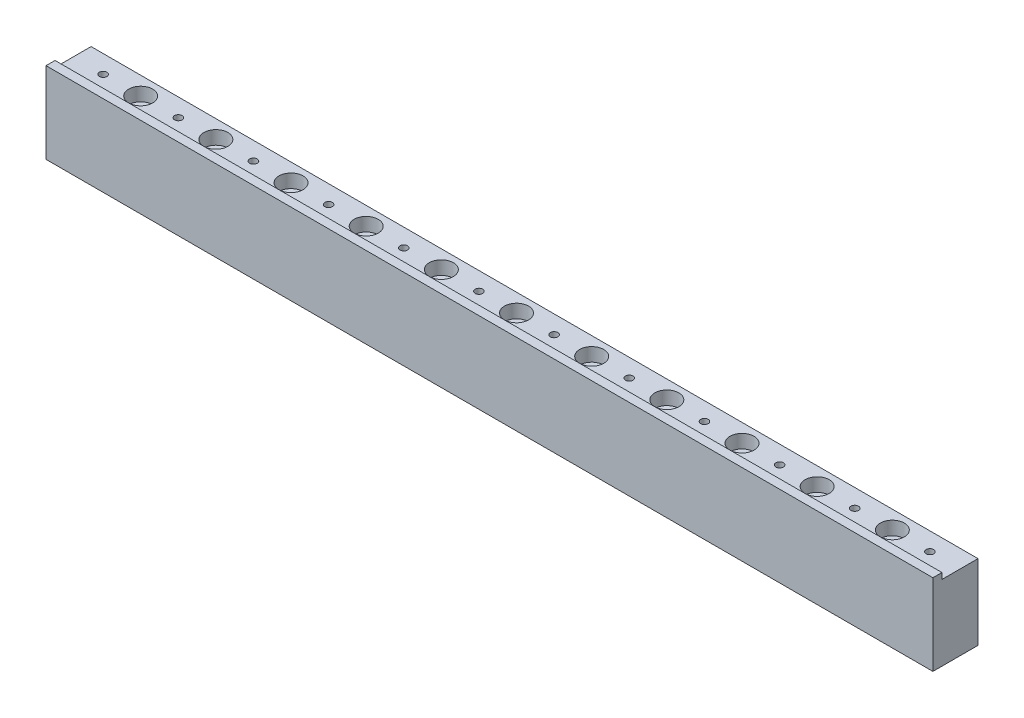
from build123d import *

# Parameters (mm, degrees)
SKETCH_2_W                   = 295
SKETCH_2_H                   = 15
EXTRUDE_1_DEPTH              = 27
PATTERN_LINEAR_1_COUNT       = 12
PATTERN_LINEAR_1_PITCH       = 25
CUT_EXTRUDE_1_REACH          = 298.37
SKETCH_6_W                   = 12
SKETCH_6_H                   = 2
HOLE_WIZARD_M4_1_D           = 4.5
HOLE_WIZARD_M4_1_CBORE_D     = 8
HOLE_WIZARD_M4_1_CBORE_DEPTH = 4.5
PATTERN_LINEAR_2_COUNT       = 11
PATTERN_LINEAR_2_PITCH       = 25


with BuildPart() as part:
    # 草图2 → 拉伸1 (new body)
    with BuildSketch(Plane(origin=(0, 0, 0), x_dir=(1, 0, 0), z_dir=(0, 1, 0))):
        with Locations((147.5, -1.5)):
            Rectangle(SKETCH_2_W, SKETCH_2_H)
    extrude(amount=EXTRUDE_1_DEPTH)

    # 草图4 → M3 螺纹孔1 (revolve, cut)
    with BuildSketch(Plane(origin=(10, 27, 0), x_dir=(0, 0, 1), z_dir=(1, 0, 0))):
        Polygon((0, 0), (0, 8.251075774), (1.25, 7.5), (1.25, 0), align=None)
    hole_wizard_m3_1 = revolve(axis=Axis((10, 33.35, 0), (0, -1, 0)), mode=Mode.SUBTRACT)

    # 阵列(线性)1: M3 螺纹孔1 ×12
    with Locations(*[(i * PATTERN_LINEAR_1_PITCH, 0, 0) for i in range(1, PATTERN_LINEAR_1_COUNT)]):
        add(hole_wizard_m3_1, mode=Mode.SUBTRACT)

    # 草图6 → 切除-拉伸1 (cut, up to next)
    with BuildSketch(Plane(origin=(295, 0, 0), x_dir=(0, 0, -1), z_dir=(1, 0, 0)), mode=Mode.PRIVATE) as cut_extrude_1_sk1:
        with Locations((0, 26)):
            Rectangle(SKETCH_6_W, SKETCH_6_H)
    cut_extrude_1_tool1 = extrude(cut_extrude_1_sk1.sketch, amount=-CUT_EXTRUDE_1_REACH, mode=Mode.PRIVATE) & part.part
    add(cut_extrude_1_tool1.solids().sort_by_distance((295, 26, 0))[0], mode=Mode.SUBTRACT)

    # M4 六角凹头螺钉的柱形沉头孔1 (through all)
    with Locations(Plane(origin=(0, 25, 0), x_dir=(-1, 0, 0), z_dir=(0, 1, 0))):
        with Locations((-22.5, 0)):
            hole_wizard_m4_1 = CounterBoreHole(HOLE_WIZARD_M4_1_D / 2, HOLE_WIZARD_M4_1_CBORE_D / 2, HOLE_WIZARD_M4_1_CBORE_DEPTH)

    # 阵列(线性)2: M4 六角凹头螺钉的柱形沉头孔1 ×11
    with Locations(*[(i * PATTERN_LINEAR_2_PITCH, 0, 0) for i in range(1, PATTERN_LINEAR_2_COUNT)]):
        add(hole_wizard_m4_1, mode=Mode.SUBTRACT)


solid = part.part
